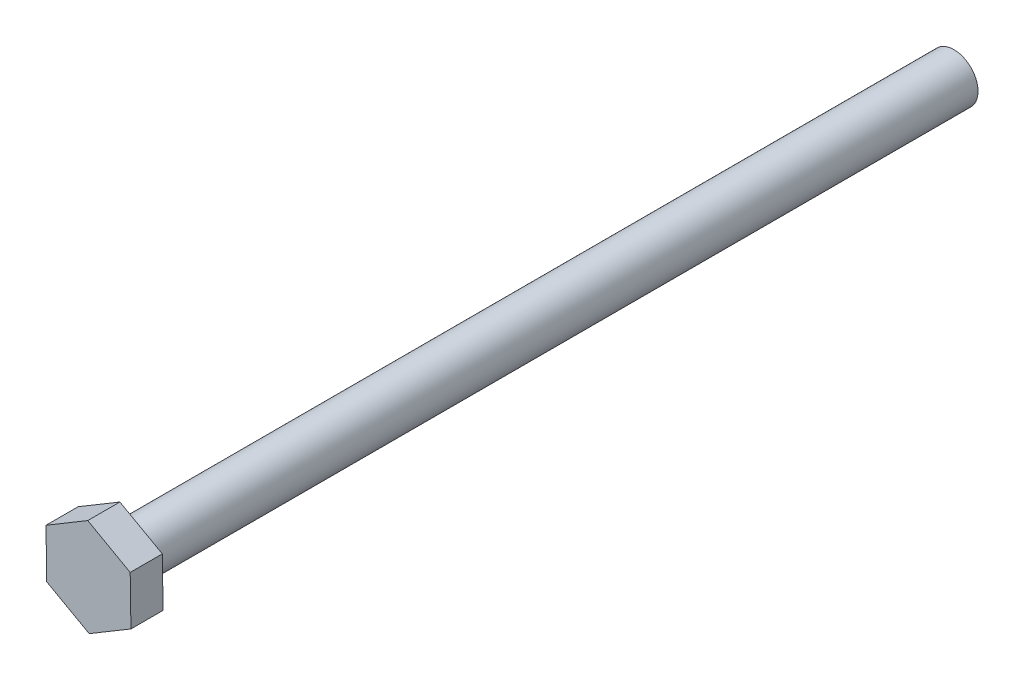
from build123d import *

# Parameters (mm, degrees)
BOSS_EXTRUDE1_DEPTH = 4.2418
SKETCH2_R           = 3.175
BOSS_EXTRUDE2_DEPTH = 109.982


with BuildPart() as part:
    # Sketch1 → Boss-Extrude1 (new body)
    with BuildSketch(Plane.XY):
        Polygon((5.507808698, 3.290379222), (-0.095647645, 6.415091863), (-5.603456344, 3.124712641), (-5.507808698, -3.290379222), (0.095647645, -6.415091863), (5.603456344, -3.124712641), align=None)
    extrude(amount=BOSS_EXTRUDE1_DEPTH)

    # Sketch2 → Boss-Extrude2 (add)
    with BuildSketch(Plane(origin=(0, 0, 0), x_dir=(-1, 0, 0), z_dir=(0, 0, -1))):
        Circle(SKETCH2_R)
    extrude(amount=BOSS_EXTRUDE2_DEPTH)


solid = part.part
